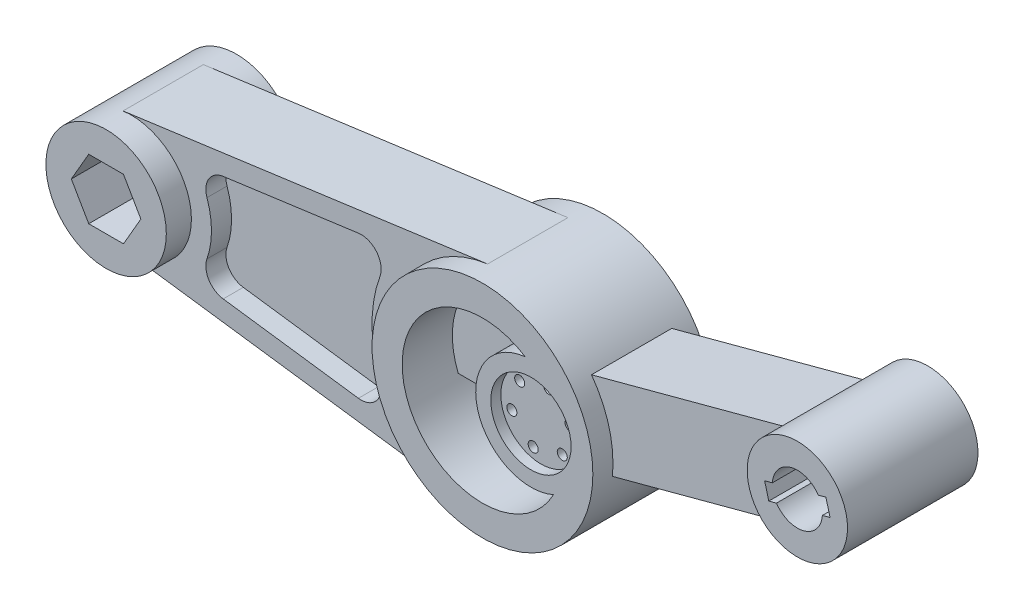
from build123d import *
from build123d.topology import SkipClean

# Parameters (mm, degrees)
LEFT_ARM_DEPTH                = 20
SKETCH2_R                     = 30
LEFT_BOSS_DEPTH               = 32.5
LEFT_HEX_DEPTH                = 255.656632
LEFT_HEX_DEPTH_BACK           = 255.656632
SKETCH3_R                     = 55
CENTRE_BOSS_DEPTH             = 30
SKETCH5_W                     = 40
SKETCH5_H                     = 40
RIGHT_ARM_DEPTH               = 165
SKETCH7_R                     = 25
RIGHT_BOSS_DEPTH              = 32.5
SKETCH8_R                     = 12.5
RIGHT_BOSS_HOLE_DEPTH         = 382.115359
SKETCH9_R                     = 40
CENTRE_HOLE_DEPTH             = 381.696949
SKETCH10_R                    = 27.5
CENTRE_BLOB_DEPTH             = 30
CENTRE_BEAM_REACH             = 229.739
SKETCH11_W                    = 10
SKETCH11_H                    = 30
CENTRE_BEAM_DIRECTION_2_REACH = 229.739
SKETCH12_R                    = 20
CUT_EXTRUDE4_DEPTH            = 5
M6X1_0_TAPPED_HOLE1_D         = 5
CIRPATTERN1_COUNT             = 6
CUT_OUT_DEPTH                 = 10
FILLET1_R                     = 10
FILLET1_OF_MIRROR2_R          = 10
KEYWAY_DEPTH                  = 377.935229


with BuildPart() as part:
    # Sketch1 → LEFT_ARM (new, symmetric)
    with BuildSketch(Plane.XY):
        with BuildLine():
            Line((-4.054054, 29.724815), (177.567568, 54.495495))
            ThreePointArc((177.567568, 54.495495), (240, 0), (177.567568, -54.495495))
            Line((177.567568, -54.495495), (-4.054054, -29.724815))
            ThreePointArc((-4.054054, -29.724815), (-30, 0), (-4.054054, 29.724815))
        make_face()
    extrude(amount=LEFT_ARM_DEPTH, both=True)

    # Sketch2 → LEFT_Boss (add, symmetric)
    with SkipClean():  # the faces are left unmerged after this step: merging them gives an invalid solid
        with BuildSketch(Plane.XY):
            Circle(SKETCH2_R)
        extrude(amount=LEFT_BOSS_DEPTH, both=True)

    # Sketch4 → LEFT_Hex (cut, two sides: drawn at the far end of the back side and taken through both)
    with SkipClean():  # the faces are left unmerged after this step: merging them gives an invalid solid
        with BuildSketch(Plane.XY.offset(32.5).offset(-LEFT_HEX_DEPTH_BACK)):
            Polygon((17.320508, 0), (8.660254, 15), (-8.660254, 15), (-17.320508, 0), (-8.660254, -15), (8.660254, -15), align=None)
        extrude(amount=LEFT_HEX_DEPTH + LEFT_HEX_DEPTH_BACK, mode=Mode.SUBTRACT)

    # Sketch3 → CENTRE_Boss (add, symmetric)
    with BuildSketch(Plane.XY):
        with Locations((185, 0)):
            Circle(SKETCH3_R)
    extrude(amount=CENTRE_BOSS_DEPTH, both=True)

    # Sketch5 → RIGHT_ARM (add)
    with BuildSketch(Plane(origin=(172.60735, 46.25, 0), x_dir=(0, 0, -1), z_dir=(0.9659258262890681, 0.25881904510252135, 0))):
        with Locations((0, -47.881523)):
            Rectangle(SKETCH5_W, SKETCH5_H)
    extrude(amount=RIGHT_ARM_DEPTH)

    # Sketch7 → RIGHT_Boss (add, symmetric)
    with BuildSketch(Plane.XY):
        with Locations((344.377761, 42.705142)):
            Circle(SKETCH7_R)
    extrude(amount=RIGHT_BOSS_DEPTH, both=True)

    # Sketch8 → RIGHT_Boss_Hole (cut, through all)
    with BuildSketch(Plane.XY.offset(32.5)):
        with Locations((344.377761, 42.705142)):
            Circle(SKETCH8_R)
    extrude(amount=-RIGHT_BOSS_HOLE_DEPTH, mode=Mode.SUBTRACT)

    # Sketch9 → CENTRE_Hole (cut, through all)
    with BuildSketch(Plane.XY.offset(30)):
        with Locations((185, 0)):
            Circle(SKETCH9_R)
    extrude(amount=-CENTRE_HOLE_DEPTH, mode=Mode.SUBTRACT)

    # Sketch10 → CENTRE_Blob (add, symmetric)
    with BuildSketch(Plane.XY):
        with Locations((209.148146, 6.470476)):
            Circle(SKETCH10_R)
    extrude(amount=CENTRE_BLOB_DEPTH, both=True)

    # Sketch11 → CENTRE_Beam (add, up to next)
    with BuildSketch(Plane(origin=(185, 0, 0), x_dir=(0, 0, -1), z_dir=(1, 0, 0)), mode=Mode.PRIVATE) as centre_beam_sk1:
        Rectangle(SKETCH11_W, SKETCH11_H)
    centre_beam_tool1 = extrude(centre_beam_sk1.sketch, amount=CENTRE_BEAM_REACH, mode=Mode.PRIVATE) - part.part
    add(centre_beam_tool1.solids().sort_by_distance((185, 0, 0))[0])

    # Sketch11 → CENTRE_Beam direction 2 (add, up to next)
    with BuildSketch(Plane(origin=(185, 0, 0), x_dir=(0, 0, -1), z_dir=(1, 0, 0)), mode=Mode.PRIVATE) as centre_beam_direction_2_sk1:
        Rectangle(SKETCH11_W, SKETCH11_H)
    centre_beam_direction_2_tool1 = extrude(centre_beam_direction_2_sk1.sketch, amount=-CENTRE_BEAM_DIRECTION_2_REACH, mode=Mode.PRIVATE) - part.part
    add(centre_beam_direction_2_tool1.solids().sort_by_distance((185, 0, 0))[0])

    # Sketch12 → Cut-Extrude4 (cut)
    with BuildSketch(Plane.XY.offset(30)):
        with Locations((209.148146, 6.470476)):
            Circle(SKETCH12_R)
    cut_extrude4 = extrude(amount=-CUT_EXTRUDE4_DEPTH, mode=Mode.SUBTRACT)

    # M6x1.0 Tapped Hole1 (through all)
    with Locations(Plane.XY.offset(25)):
        with Locations((194.659258, 2.58819)):
            m6x1_0_tapped_hole1 = Hole(M6X1_0_TAPPED_HOLE1_D / 2)

    # CirPattern1: M6x1.0 Tapped Hole1 ×6 about axis
    cirpattern1_axis = Axis((209.148146, 6.470476, 0), (0, 0, 1))
    for i in range(1, CIRPATTERN1_COUNT):
        add(m6x1_0_tapped_hole1.rotate(cirpattern1_axis, i * 360 / CIRPATTERN1_COUNT), mode=Mode.SUBTRACT)

    # Mirror1: Cut-Extrude4 across plane
    add(cut_extrude4.mirror(Plane.XY), mode=Mode.SUBTRACT)

    # Sketch15 → Cut_OUT (cut)
    with BuildSketch(Plane.XY.offset(20)):
        with BuildLine():
            Line((132.445005, 38.248823), (31.620558, 24.497762))
            ThreePointArc((31.620558, 24.497762), (40, 0), (31.620558, -24.497762))
            Line((31.620558, -24.497762), (132.445005, -38.248823))
            ThreePointArc((132.445005, -38.248823), (120, 0), (132.445005, 38.248823))
        make_face()
    cut_out = extrude(amount=-CUT_OUT_DEPTH, mode=Mode.SUBTRACT)

    # Fillet1
    fillet1_edges = [part.edges().sort_by_distance(p)[0] for p in [
        (31.620558, -24.497762, 15),
        (31.620558, 24.497762, 15),
        (132.445005, 38.248823, 15),
        (132.445005, -38.248823, 15),
    ]]
    fillet(fillet1_edges, radius=FILLET1_R)

    # Mirror2: Cut_OUT across plane
    with SkipClean():  # the faces are left unmerged after this step: merging them gives an invalid solid
        add(cut_out.mirror(Plane.XY), mode=Mode.SUBTRACT)

    # Fillet1 of Mirror2
    fillet1_of_mirror2_edges = [part.edges().sort_by_distance(p)[0] for p in [
        (31.620558, -24.497762, -15),
        (31.620558, 24.497762, -15),
        (132.445005, 38.248823, -15),
        (132.445005, -38.248823, -15),
    ]]
    fillet(fillet1_of_mirror2_edges, radius=FILLET1_OF_MIRROR2_R)

    # Sketch16 → KEYWAY (cut, symmetric)
    with SkipClean():  # the faces are left unmerged after this step: merging them gives an invalid solid
        with BuildSketch(Plane.XY):
            Polygon((345.413038, 38.841439), (343.342485, 46.568846), (328.080857, 42.479505), (330.151409, 34.752098), align=None)
        keyway = extrude(amount=KEYWAY_DEPTH, both=True, mode=Mode.SUBTRACT)

    # Mirror3: KEYWAY across plane
    with SkipClean():  # the faces are left unmerged after this step: merging them gives an invalid solid
        add(keyway.mirror(Plane(origin=(331.985111, 88.955142, 0), x_dir=(0, 0, 1), z_dir=(0.9659258262890681, 0.25881904510252135, 0))), mode=Mode.SUBTRACT)


solid = part.part
